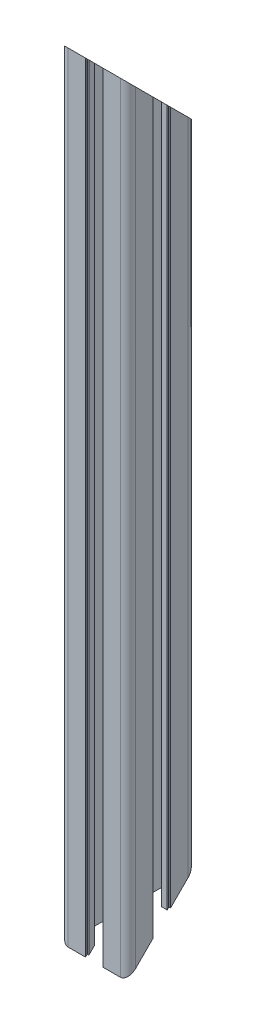
from build123d import *

# Parameters (mm, degrees)
SKETCH3_R               = 3.4
BOSS_EXTRUDE1_DEPTH     = 500
CUT_EXTRUDE1_DEPTH      = 501.799361022
CUT_EXTRUDE1_DEPTH_BACK = 501.799361022


with BuildPart() as part:
    # Sketch3 → Boss-Extrude1 (new body)
    with BuildSketch(Plane(origin=(0, 0, 0), x_dir=(1, 0, 0), z_dir=(0, 1, 0))):
        with BuildLine():
            Line((-5.1, 19.2), (-5.1, 20))
            Line((-5.1, 20), (-15.5, 20))
            ThreePointArc((-15.5, 20), (-18.681980515, 18.681980515), (-20, 15.5))
            Line((-20, 15.5), (-20, 5.1))
            Line((-20, 5.1), (-19.2, 5.1))
            ThreePointArc((-19.2, 5.1), (-19.058578644, 5.041421356), (-19, 4.9))
            Line((-19, 4.9), (-19, 4.1))
            Line((-19, 4.1), (-15.7, 4.1))
            ThreePointArc((-15.7, 4.1), (-15.558578644, 4.158578644), (-15.5, 4.3))
            Line((-15.5, 4.3), (-15.5, 5.6))
            ThreePointArc((-15.5, 5.6), (-15.558578644, 5.741421356), (-15.7, 5.8))
            Line((-15.7, 5.8), (-17, 5.8))
            ThreePointArc((-17, 5.8), (-17.707106781, 6.092893219), (-18, 6.8))
            Line((-18, 6.8), (-18, 9.25))
            ThreePointArc((-18, 9.25), (-17.707106781, 9.957106781), (-17, 10.25))
            Line((-17, 10.25), (-12.017766953, 10.25))
            Line((-12.017766953, 10.25), (-7.7, 5.932233047))
            Line((-7.7, 5.932233047), (-7.7, 4.1))
            Line((-7.7, 4.1), (-7.7, -5.932233047))
            Line((-7.7, -5.932233047), (-12.017766953, -10.25))
            Line((-12.017766953, -10.25), (-17, -10.25))
            ThreePointArc((-17, -10.25), (-17.707106781, -9.957106781), (-18, -9.25))
            Line((-18, -9.25), (-18, -6.8))
            ThreePointArc((-18, -6.8), (-17.707106781, -6.092893219), (-17, -5.8))
            Line((-17, -5.8), (-15.7, -5.8))
            ThreePointArc((-15.7, -5.8), (-15.558578644, -5.741421356), (-15.5, -5.6))
            Line((-15.5, -5.6), (-15.5, -4.3))
            ThreePointArc((-15.5, -4.3), (-15.558578644, -4.158578644), (-15.7, -4.1))
            Line((-15.7, -4.1), (-19, -4.1))
            Line((-19, -4.1), (-19, -4.9))
            ThreePointArc((-19, -4.9), (-19.058578644, -5.041421356), (-19.2, -5.1))
            Line((-19.2, -5.1), (-20, -5.1))
            Line((-20, -5.1), (-20, -15.5))
            ThreePointArc((-20, -15.5), (-18.681980515, -18.681980515), (-15.5, -20))
            Line((-15.5, -20), (-5.1, -20))
            Line((-5.1, -20), (-5.1, -19.2))
            ThreePointArc((-5.1, -19.2), (-5.041421356, -19.058578644), (-4.9, -19))
            Line((-4.9, -19), (-4.1, -19))
            Line((-4.1, -19), (-4.1, -15.7))
            ThreePointArc((-4.1, -15.7), (-4.158578644, -15.558578644), (-4.3, -15.5))
            Line((-4.3, -15.5), (-5.6, -15.5))
            ThreePointArc((-5.6, -15.5), (-5.741421356, -15.558578644), (-5.8, -15.7))
            Line((-5.8, -15.7), (-5.8, -17))
            ThreePointArc((-5.8, -17), (-6.092893219, -17.707106781), (-6.8, -18))
            Line((-6.8, -18), (-9.25, -18))
            ThreePointArc((-9.25, -18), (-9.957106781, -17.707106781), (-10.25, -17))
            Line((-10.25, -17), (-10.25, -12.017766953))
            Line((-10.25, -12.017766953), (-5.932233047, -7.7))
            Line((-5.932233047, -7.7), (5.932233047, -7.7))
            Line((5.932233047, -7.7), (10.25, -12.017766953))
            Line((10.25, -12.017766953), (10.25, -17))
            ThreePointArc((10.25, -17), (9.957106781, -17.707106781), (9.25, -18))
            Line((9.25, -18), (6.8, -18))
            ThreePointArc((6.8, -18), (6.092893219, -17.707106781), (5.8, -17))
            Line((5.8, -17), (5.8, -15.7))
            ThreePointArc((5.8, -15.7), (5.741421356, -15.558578644), (5.6, -15.5))
            Line((5.6, -15.5), (4.3, -15.5))
            ThreePointArc((4.3, -15.5), (4.158578644, -15.558578644), (4.1, -15.7))
            Line((4.1, -15.7), (4.1, -19))
            Line((4.1, -19), (4.9, -19))
            ThreePointArc((4.9, -19), (5.041421356, -19.058578644), (5.1, -19.2))
            Line((5.1, -19.2), (5.1, -20))
            Line((5.1, -20), (15.5, -20))
            ThreePointArc((15.5, -20), (18.681980515, -18.681980515), (20, -15.5))
            Line((20, -15.5), (20, -5.1))
            Line((20, -5.1), (19.2, -5.1))
            ThreePointArc((19.2, -5.1), (19.058578644, -5.041421356), (19, -4.9))
            Line((19, -4.9), (19, -4.1))
            Line((19, -4.1), (15.7, -4.1))
            ThreePointArc((15.7, -4.1), (15.558578644, -4.158578644), (15.5, -4.3))
            Line((15.5, -4.3), (15.5, -5.6))
            ThreePointArc((15.5, -5.6), (15.558578644, -5.741421356), (15.7, -5.8))
            Line((15.7, -5.8), (17, -5.8))
            ThreePointArc((17, -5.8), (17.707106781, -6.092893219), (18, -6.8))
            Line((18, -6.8), (18, -9.25))
            ThreePointArc((18, -9.25), (17.707106781, -9.957106781), (17, -10.25))
            Line((17, -10.25), (12.017766953, -10.25))
            Line((12.017766953, -10.25), (7.7, -5.932233047))
            Line((7.7, -5.932233047), (7.7, 5.932233047))
            Line((7.7, 5.932233047), (12.017766953, 10.25))
            Line((12.017766953, 10.25), (17, 10.25))
            ThreePointArc((17, 10.25), (17.707106781, 9.957106781), (18, 9.25))
            Line((18, 9.25), (18, 6.8))
            ThreePointArc((18, 6.8), (17.707106781, 6.092893219), (17, 5.8))
            Line((17, 5.8), (15.7, 5.8))
            ThreePointArc((15.7, 5.8), (15.558578644, 5.741421356), (15.5, 5.6))
            Line((15.5, 5.6), (15.5, 4.3))
            ThreePointArc((15.5, 4.3), (15.558578644, 4.158578644), (15.7, 4.1))
            Line((15.7, 4.1), (19, 4.1))
            Line((19, 4.1), (19, 4.9))
            ThreePointArc((19, 4.9), (19.058578644, 5.041421356), (19.2, 5.1))
            Line((19.2, 5.1), (20, 5.1))
            Line((20, 5.1), (20, 15.5))
            ThreePointArc((20, 15.5), (18.681980515, 18.681980515), (15.5, 20))
            Line((15.5, 20), (5.1, 20))
            Line((5.1, 20), (5.1, 19.2))
            ThreePointArc((5.1, 19.2), (5.041421356, 19.058578644), (4.9, 19))
            Line((4.9, 19), (4.1, 19))
            Line((4.1, 19), (4.1, 15.7))
            ThreePointArc((4.1, 15.7), (4.158578644, 15.558578644), (4.3, 15.5))
            Line((4.3, 15.5), (5.6, 15.5))
            ThreePointArc((5.6, 15.5), (5.741421356, 15.558578644), (5.8, 15.7))
            Line((5.8, 15.7), (5.8, 17))
            ThreePointArc((5.8, 17), (6.092893219, 17.707106781), (6.8, 18))
            Line((6.8, 18), (9.25, 18))
            ThreePointArc((9.25, 18), (9.957106781, 17.707106781), (10.25, 17))
            Line((10.25, 17), (10.25, 12.017766953))
            Line((10.25, 12.017766953), (5.932233047, 7.7))
            Line((5.932233047, 7.7), (-5.932233047, 7.7))
            Line((-5.932233047, 7.7), (-10.25, 12.017766953))
            Line((-10.25, 12.017766953), (-10.25, 17))
            ThreePointArc((-10.25, 17), (-9.957106781, 17.707106781), (-9.25, 18))
            Line((-9.25, 18), (-6.8, 18))
            ThreePointArc((-6.8, 18), (-6.092893219, 17.707106781), (-5.8, 17))
            Line((-5.8, 17), (-5.8, 15.7))
            ThreePointArc((-5.8, 15.7), (-5.741421356, 15.558578644), (-5.6, 15.5))
            Line((-5.6, 15.5), (-4.3, 15.5))
            ThreePointArc((-4.3, 15.5), (-4.158578644, 15.558578644), (-4.1, 15.7))
            Line((-4.1, 15.7), (-4.1, 19))
            Line((-4.1, 19), (-4.9, 19))
            ThreePointArc((-4.9, 19), (-5.041421356, 19.058578644), (-5.1, 19.2))
        make_face()
        with BuildLine():
            Line((-11.75, -12.75), (-11.75, -17))
            ThreePointArc((-11.75, -17), (-12.042893219, -17.707106781), (-12.75, -18))
            Line((-12.75, -18), (-15.5, -18))
            ThreePointArc((-15.5, -18), (-17.267766953, -17.267766953), (-18, -15.5))
            Line((-18, -15.5), (-18, -12.75))
            ThreePointArc((-18, -12.75), (-17.707106781, -12.042893219), (-17, -11.75))
            Line((-17, -11.75), (-12.75, -11.75))
            ThreePointArc((-12.75, -11.75), (-12.042893219, -12.042893219), (-11.75, -12.75))
        make_face(mode=Mode.SUBTRACT)
        with Locations(Location((0, 0, 0), (0, 0, 270))):
            Circle(SKETCH3_R, mode=Mode.SUBTRACT)
        with BuildLine():
            Line((-15.5, 18), (-12.75, 18))
            ThreePointArc((-12.75, 18), (-12.042893219, 17.707106781), (-11.75, 17))
            Line((-11.75, 17), (-11.75, 12.75))
            ThreePointArc((-11.75, 12.75), (-12.042893219, 12.042893219), (-12.75, 11.75))
            Line((-12.75, 11.75), (-17, 11.75))
            ThreePointArc((-17, 11.75), (-17.707106781, 12.042893219), (-18, 12.75))
            Line((-18, 12.75), (-18, 15.5))
            ThreePointArc((-18, 15.5), (-17.267766953, 17.267766953), (-15.5, 18))
        make_face(mode=Mode.SUBTRACT)
        with BuildLine():
            ThreePointArc((12.75, 11.75), (12.042893219, 12.042893219), (11.75, 12.75))
            Line((11.75, 12.75), (11.75, 17))
            ThreePointArc((11.75, 17), (12.042893219, 17.707106781), (12.75, 18))
            Line((12.75, 18), (15.5, 18))
            ThreePointArc((15.5, 18), (17.267766953, 17.267766953), (18, 15.5))
            Line((18, 15.5), (18, 12.75))
            ThreePointArc((18, 12.75), (17.707106781, 12.042893219), (17, 11.75))
            Line((17, 11.75), (12.75, 11.75))
        make_face(mode=Mode.SUBTRACT)
        with BuildLine():
            Line((11.75, -17), (11.75, -12.75))
            ThreePointArc((11.75, -12.75), (12.042893219, -12.042893219), (12.75, -11.75))
            Line((12.75, -11.75), (17, -11.75))
            ThreePointArc((17, -11.75), (17.707106781, -12.042893219), (18, -12.75))
            Line((18, -12.75), (18, -15.5))
            ThreePointArc((18, -15.5), (17.267766953, -17.267766953), (15.5, -18))
            Line((15.5, -18), (12.75, -18))
            ThreePointArc((12.75, -18), (12.042893219, -17.707106781), (11.75, -17))
        make_face(mode=Mode.SUBTRACT)
    extrude(amount=BOSS_EXTRUDE1_DEPTH)

    # Sketch4 → Cut-Extrude1 (cut, two sides: drawn at the far end of the back side and taken through both)
    with BuildSketch(Plane(origin=(0, 0, 0), x_dir=(0, 0, -1), z_dir=(1, 0, 0)).offset(-CUT_EXTRUDE1_DEPTH_BACK)):
        Polygon((20, 40), (-20, 0), (20, 0), align=None)
        Polygon((-20, 500), (-20, 459.619407771), (20, 419.619407771), (20, 500), align=None)
    extrude(amount=CUT_EXTRUDE1_DEPTH + CUT_EXTRUDE1_DEPTH_BACK, mode=Mode.SUBTRACT)


solid = part.part
